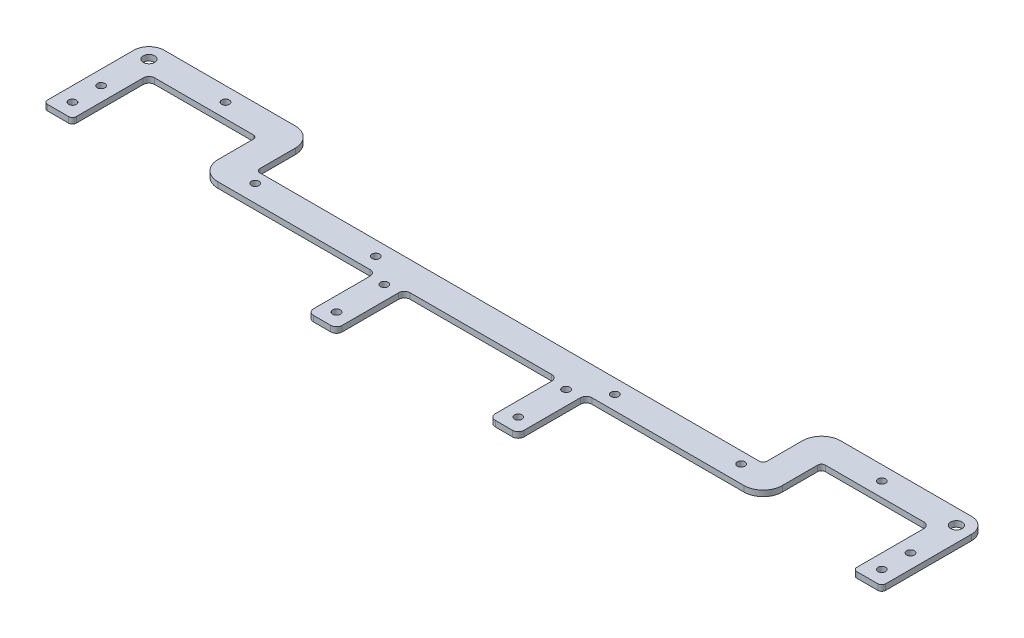
from build123d import *

# Parameters (mm, degrees)
EXTRUDE_1_DEPTH     = 3
SKETCH_2_R          = 2
SKETCH_2_W          = 80
SKETCH_2_H          = 35.5
CUT_EXTRUDE_1_DEPTH = 10
SKETCH_5_R          = 3
CUT_EXTRUDE_4_DEPTH = 234.518735865
FILLET_1_R          = 10
FILLET_2_R          = 3
FILLET_3_R          = 2


with BuildPart() as part:
    # 草图1 → 凸台-拉伸1 (new body)
    with BuildSketch(Plane(origin=(0, 0, 0), x_dir=(1, 0, 0), z_dir=(0, 1, 0))):
        with BuildLine():
            Line((-55, 0), (55, 0))
            Line((55, 0), (55, 35.5))
            Line((55, 35.5), (147.5, 35.5))
            Line((147.5, 35.5), (147.5, 66))
            Line((147.5, 66), (204, 66))
            Line((204, 66), (204, 26))
            Line((204, 26), (219, 26))
            Line((219, 26), (219, 73))
            ThreePointArc((219, 73), (216.656854249, 78.656854249), (211, 81))
            Line((211, 81), (132.5, 81))
            Line((132.5, 81), (132.5, 50.5))
            Line((132.5, 50.5), (-132.5, 50.5))
            Line((-132.5, 50.5), (-132.5, 81))
            Line((-132.5, 81), (-211, 81))
            ThreePointArc((-211, 81), (-216.656854249, 78.656854249), (-219, 73))
            Line((-219, 73), (-219, 26))
            Line((-219, 26), (-204, 26))
            Line((-204, 26), (-204, 66))
            Line((-204, 66), (-147.5, 66))
            Line((-147.5, 66), (-147.5, 35.5))
            Line((-147.5, 35.5), (-55, 35.5))
            Line((-55, 35.5), (-55, 0))
        make_face()
    extrude(amount=EXTRUDE_1_DEPTH)

    # 草图2 → 切除-拉伸1 (cut)
    with BuildSketch(Plane(origin=(0, 3, 0), x_dir=(1, 0, 0), z_dir=(0, 1, 0))):
        with Locations(Location((-47.5, 32.5, 0), (0, 0, 270))):
            Circle(SKETCH_2_R)
        with Locations(Location((-211.5, 33.5, 0), (0, 0, 270))):
            Circle(SKETCH_2_R)
        with Locations(Location((-211.5, 48.5, 0), (0, 0, 270))):
            Circle(SKETCH_2_R)
        with Locations(Location((211.5, 48.5, 0), (0, 0, 270))):
            Circle(SKETCH_2_R)
        with Locations(Location((211.5, 33.5, 0), (0, 0, 270))):
            Circle(SKETCH_2_R)
        with Locations(Location((-171.5, 73.5, 0), (0, 0, 270))):
            Circle(SKETCH_2_R)
        with Locations(Location((171.5, 73.5, 0), (0, 0, 270))):
            Circle(SKETCH_2_R)
        with Locations(Location((47.5, 32.5, 0), (0, 0, 270))):
            Circle(SKETCH_2_R)
        with Locations(Location((-47.5, 7.5, 0), (0, 0, 270))):
            Circle(SKETCH_2_R)
        with Locations(Location((-62.5, 43, 0), (0, 0, 270))):
            Circle(SKETCH_2_R)
        with Locations(Location((-126.999999701, 44.500000154, 0), (0, 0, 270))):
            Circle(SKETCH_2_R)
        with Locations(Location((62.5, 43, 0), (0, 0, 270))):
            Circle(SKETCH_2_R)
        with Locations(Location((126.999999701, 44.500000154, 0), (0, 0, 270))):
            Circle(SKETCH_2_R)
        with Locations(Location((47.5, 7.5, 0), (0, 0, 270))):
            Circle(SKETCH_2_R)
        with Locations((0, 17.75)):
            Rectangle(SKETCH_2_W, SKETCH_2_H)
    extrude(amount=-CUT_EXTRUDE_1_DEPTH, mode=Mode.SUBTRACT)

    # 草图5 → 切除-拉伸4 (cut, through all)
    with BuildSketch(Plane(origin=(0, 3, 0), x_dir=(1, 0, 0), z_dir=(0, 1, 0))):
        with Locations(Location((-211, 73, 0), (0, 0, 270))):
            Circle(SKETCH_5_R)
        with Locations(Location((211, 73, 0), (0, 0, 90))):
            Circle(SKETCH_5_R)
    extrude(amount=-CUT_EXTRUDE_4_DEPTH, mode=Mode.SUBTRACT)

    # 圆角1
    fillet_1_edges = [part.edges().sort_by_distance(p)[0] for p in [
        (-147.5, 1.5, -35.5),
        (-132.5, 1.5, -81),
        (132.5, 1.5, -81),
        (147.5, 1.5, -35.5),
    ]]
    fillet(fillet_1_edges, radius=FILLET_1_R)

    # 圆角2
    fillet_2_edges = [part.edges().sort_by_distance(p)[0] for p in [
        (55, 1.5, 0),
        (-55, 1.5, 0),
        (-55, 1.5, -35.5),
        (-204, 1.5, -66),
        (204, 1.5, -66),
        (55, 1.5, -35.5),
        (-40, 1.5, 0),
        (-40, 1.5, -35.5),
        (40, 1.5, -35.5),
        (40, 1.5, 0),
    ]]
    fillet(fillet_2_edges, radius=FILLET_2_R)

    # 圆角3
    fillet_3_edges = [part.edges().sort_by_distance(p)[0] for p in [
        (-147.5, 1.5, -66),
        (-204, 1.5, -26),
        (-219, 1.5, -26),
        (-132.5, 1.5, -50.5),
        (132.5, 1.5, -50.5),
        (219, 1.5, -26),
        (204, 1.5, -26),
        (147.5, 1.5, -66),
    ]]
    fillet(fillet_3_edges, radius=FILLET_3_R)


solid = part.part
